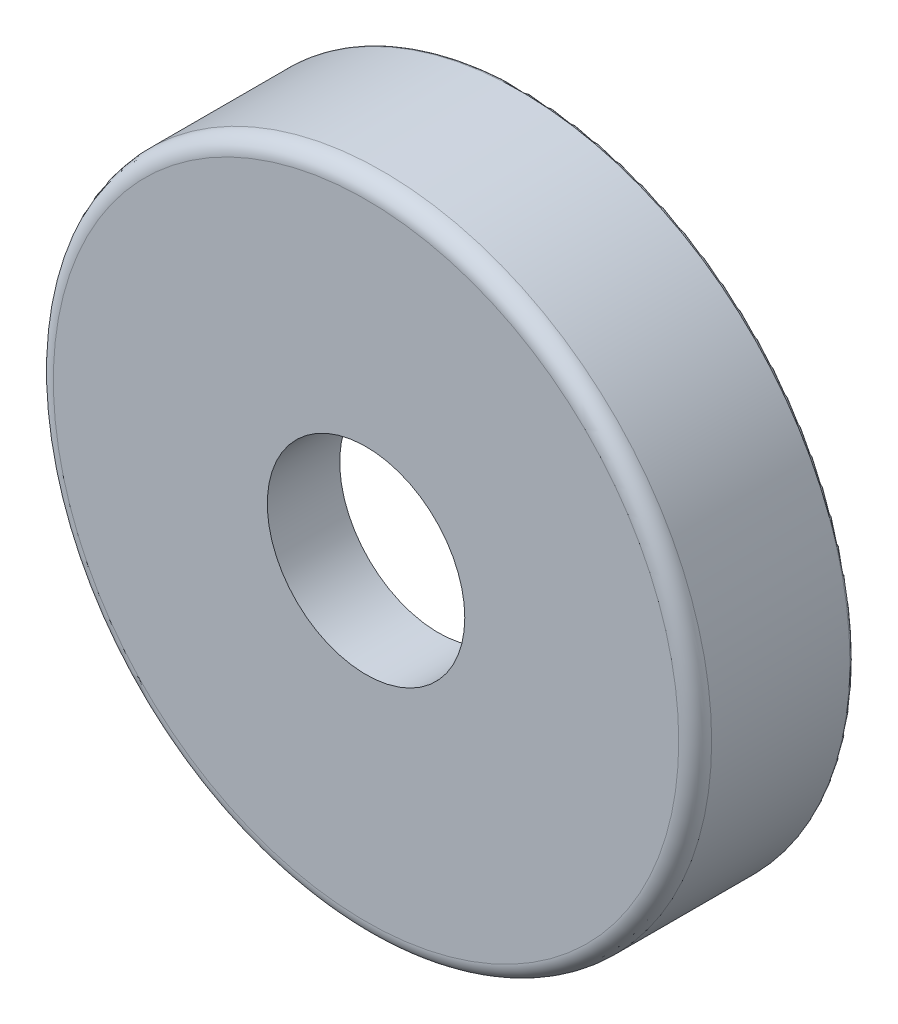
from build123d import *

# Parameters (mm, degrees)
SKETCH1_R           = 10
SKETCH1_R_2         = 3
BOSS_EXTRUDE1_DEPTH = 4.8
FILLET1_R           = 0.5
FILLET2_R           = 0.1


with BuildPart() as part:
    # Sketch1 → Boss-Extrude1 (new body)
    with BuildSketch(Plane.XY):
        Circle(SKETCH1_R)
        Circle(SKETCH1_R_2, mode=Mode.SUBTRACT)
    extrude(amount=BOSS_EXTRUDE1_DEPTH)

    # Sketch2 → Cut-Revolve1 (revolve, cut)
    with BuildSketch(Plane(origin=(0, 0, 0), x_dir=(1, 0, 0), z_dir=(0, 1, 0)), mode=Mode.PRIVATE) as cut_revolve1_sk:
        with BuildLine():
            Line((-8.5, -1), (-8.5, -1.8))
            ThreePointArc((-8.5, -1.8), (-8.207106781, -2.507106781), (-7.5, -2.8))
            Line((-7.5, -2.8), (-4, -2.8))
            Line((-4, -2.8), (-4, -2.6))
            Line((-4, -2.6), (-3, -2.6))
            Line((-3, -2.6), (-3, 0))
            Line((-3, 0), (-8.5, 0))
            Line((-8.5, 0), (-9.5, 0))
            ThreePointArc((-9.5, 0), (-8.792893219, -0.292893219), (-8.5, -1))
        make_face()
    revolve(cut_revolve1_sk.sketch.rotate(Axis((0, 0, 0), (0, 0, -1)), 180), axis=Axis((0, 0, 0), (0, 0, -1)), mode=Mode.SUBTRACT)

    # Fillet1
    fillet1_edges = [part.edges().sort_by_distance(p)[0] for p in [
        (-10, 0, 4.8),
    ]]
    fillet(fillet1_edges, radius=FILLET1_R)

    # Fillet2
    fillet2_edges = [part.edges().sort_by_distance(p)[0] for p in [
        (-10, 0, 0),
    ]]
    fillet(fillet2_edges, radius=FILLET2_R)


solid = part.part
